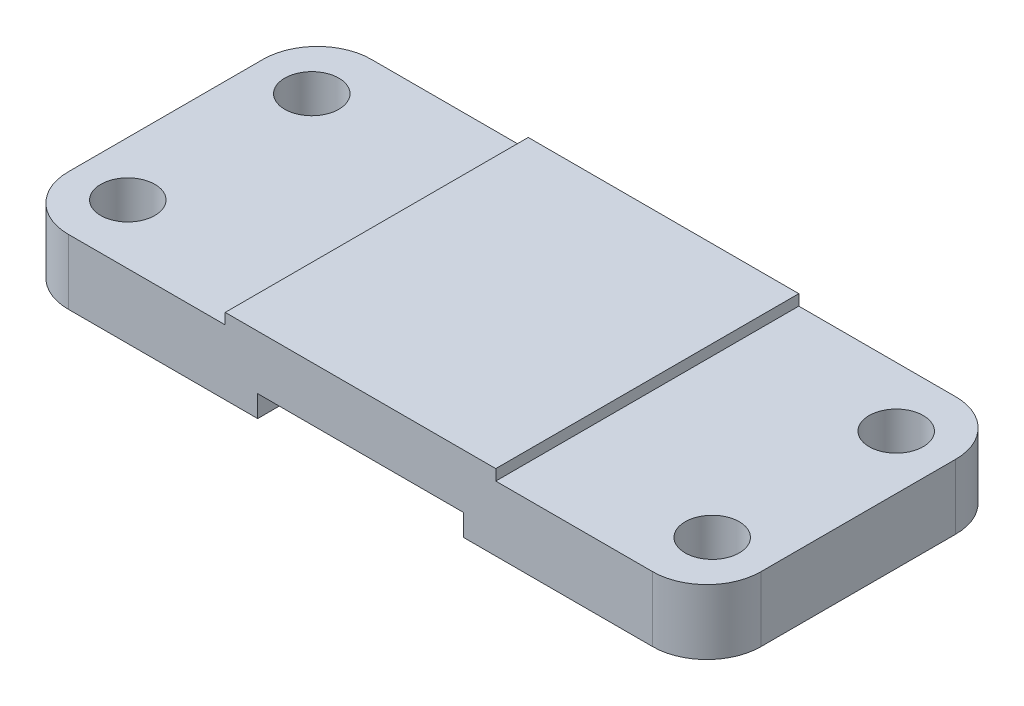
from build123d import *

# Parameters (mm, degrees)
Y_KSEKLIK_EKSTR_ZYON1_DEPTH = 56
RADYUS1_R                   = 10
IZIM2_R                     = 5
KES_EKSTR_ZYON1_DEPTH       = 130.760913174


with BuildPart() as part:
    # Çizim1 → Yükseklik-Ekstrüzyon1 (new body)
    with BuildSketch(Plane.XY):
        Polygon((-33.438372489, 12.291666667), (11.561627511, 12.291666667), (11.561627511, 24.291666667), (-27.438372489, 24.291666667), (-27.438372489, 26.291666667), (-77.438372489, 26.291666667), (-77.438372489, 24.291666667), (-116.438372489, 24.291666667), (-116.438372489, 12.291666667), (-71.438372489, 12.291666667), (-71.438372489, 16.291666667), (-33.438372489, 16.291666667), align=None)
    extrude(amount=Y_KSEKLIK_EKSTR_ZYON1_DEPTH)

    # Radyus1
    radyus1_edges = [part.edges().sort_by_distance(p)[0] for p in [
        (11.561627511, 18.291666667, 0),
        (-116.438372489, 18.291666667, 0),
        (11.561627511, 18.291666667, 56),
        (-116.438372489, 18.291666667, 56),
    ]]
    fillet(radyus1_edges, radius=RADYUS1_R)

    # Çizim2 → Kes-Ekstrüzyon1 (cut, through all)
    with BuildSketch(Plane(origin=(0, 24.291666667, 0), x_dir=(1, 0, 0), z_dir=(0, 1, 0))):
        with Locations(Location((-106.438372489, -11, 0), (0, 0, 180))):
            Circle(IZIM2_R)
        with Locations(Location((-106.438372489, -45, 0), (0, 0, 180))):
            Circle(IZIM2_R)
        with Locations(Location((1.561627511, -45, 0), (0, 0, 180))):
            Circle(IZIM2_R)
        with Locations(Location((1.561627511, -11, 0), (0, 0, 180))):
            Circle(IZIM2_R)
    extrude(amount=-KES_EKSTR_ZYON1_DEPTH, mode=Mode.SUBTRACT)


solid = part.part
